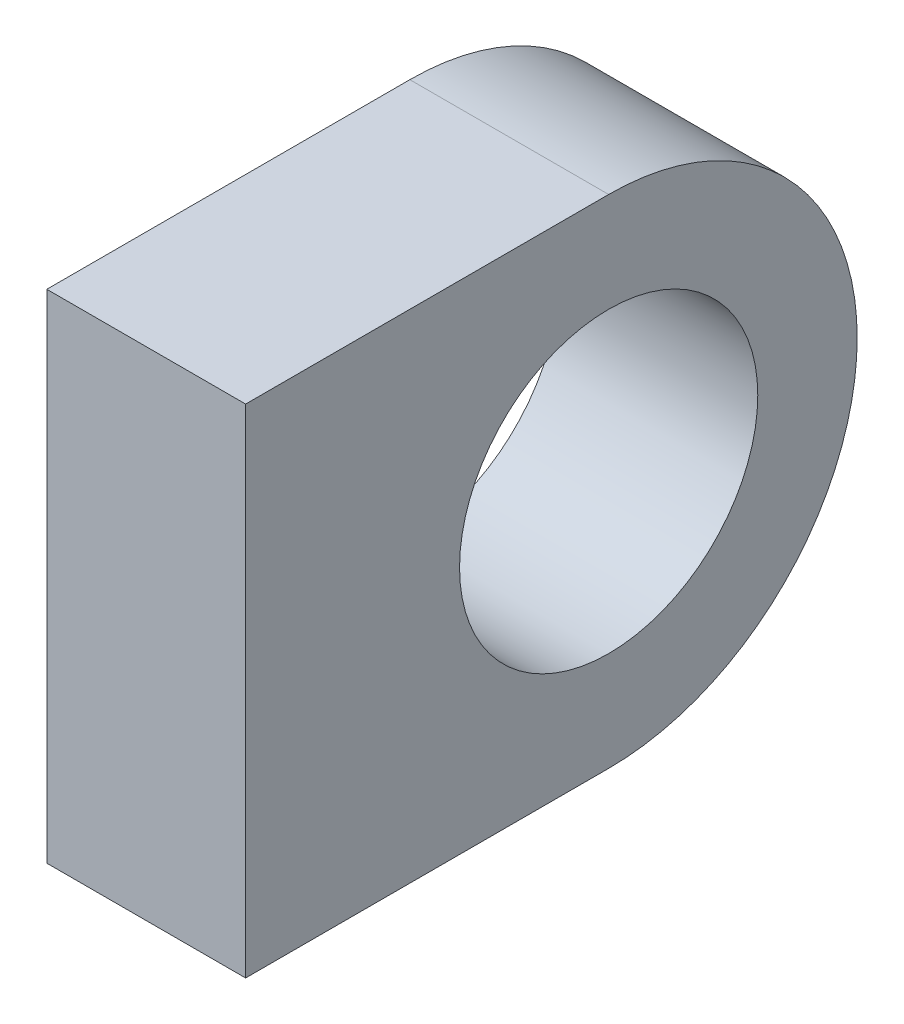
from build123d import *

# Parameters (mm, degrees)
SKETCH1_R           = 7.5
BOSS_EXTRUDE1_DEPTH = 10


with BuildPart() as part:
    # Sketch1 → Boss-Extrude1 (new body)
    with BuildSketch(Plane(origin=(0, 0, 0), x_dir=(0, 0, -1), z_dir=(1, 0, 0))):
        with BuildLine():
            Line((0, 12.5), (-18.2590535, 12.5))
            Line((-18.2590535, 12.5), (-18.2590535, -12.5))
            Line((-18.2590535, -12.5), (0, -12.5))
            ThreePointArc((0, -12.5), (12.5, 0), (0, 12.5))
        make_face()
        Circle(SKETCH1_R, mode=Mode.SUBTRACT)
    extrude(amount=BOSS_EXTRUDE1_DEPTH)


solid = part.part
